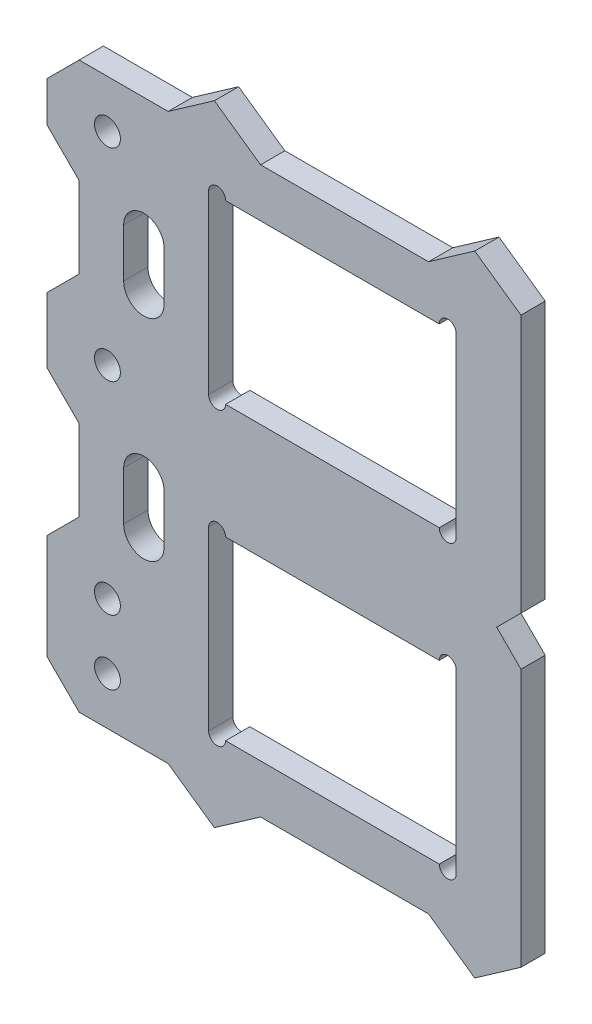
from build123d import *

# Parameters (mm, degrees)
SKETCH_1_R      = 1.6
EXTRUDE_1_DEPTH = 3
CHAMFER_1_SIZE  = 4


with BuildPart() as part:
    # 草图1 → 凸台-拉伸1 (new body)
    with BuildSketch(Plane.XY):
        Polygon((-20.3, 16.9), (-35.3, 16.9), (-35.3, 8), (-31.3, 4), (-31.3, -6), (-35.3, -10), (-35.3, -18), (-31.3, -22), (-31.3, -32), (-35.3, -36), (-35.3, -52.9), (-20.3, -52.9), (-14.587407973, -56.9), (-8.874815946, -52.9), (11.874815946, -52.9), (17.587407973, -56.9), (23.3, -52.9), (23.3, -21), (20.3, -18), (23.3, -15), (23.3, 16.9), (17.587407973, 20.9), (11.874815946, 16.9), (-8.874815946, 16.9), (-14.587407973, 20.9), align=None)
        with Locations((-27.8, -47)):
            Circle(SKETCH_1_R, mode=Mode.SUBTRACT)
        with Locations((-27.8, -39)):
            Circle(SKETCH_1_R, mode=Mode.SUBTRACT)
        with BuildLine():
            ThreePointArc((-20.8, -30), (-23.3, -32.5), (-25.8, -30))
            Line((-25.8, -30), (-25.8, -24))
            ThreePointArc((-25.8, -24), (-23.3, -21.5), (-20.8, -24))
            Line((-20.8, -24), (-20.8, -30))
        make_face(mode=Mode.SUBTRACT)
        with BuildLine():
            Line((13.2, -46.9), (-13.2, -46.9))
            ThreePointArc((-13.2, -46.9), (-14.25, -47.95), (-15.3, -46.9))
            Line((-15.3, -46.9), (-15.3, -25.1))
            ThreePointArc((-15.3, -25.1), (-14.25, -24.05), (-13.2, -25.1))
            Line((-13.2, -25.1), (13.2, -25.1))
            ThreePointArc((13.2, -25.1), (14.25, -24.05), (15.3, -25.1))
            Line((15.3, -25.1), (15.3, -46.9))
            ThreePointArc((15.3, -46.9), (14.25, -47.95), (13.2, -46.9))
        make_face(mode=Mode.SUBTRACT)
        with Locations((-27.8, -14)):
            Circle(SKETCH_1_R, mode=Mode.SUBTRACT)
        with BuildLine():
            Line((-25.8, -4), (-25.8, 2))
            ThreePointArc((-25.8, 2), (-23.3, 4.5), (-20.8, 2))
            Line((-20.8, 2), (-20.8, -4))
            ThreePointArc((-20.8, -4), (-23.3, -6.5), (-25.8, -4))
        make_face(mode=Mode.SUBTRACT)
        with Locations((-27.8, 11)):
            Circle(SKETCH_1_R, mode=Mode.SUBTRACT)
        with BuildLine():
            Line((13.2, -10.9), (-13.2, -10.9))
            ThreePointArc((-13.2, -10.9), (-14.25, -11.95), (-15.3, -10.9))
            Line((-15.3, -10.9), (-15.3, 10.9))
            ThreePointArc((-15.3, 10.9), (-14.25, 11.95), (-13.2, 10.9))
            Line((-13.2, 10.9), (13.2, 10.9))
            ThreePointArc((13.2, 10.9), (14.25, 11.95), (15.3, 10.9))
            Line((15.3, 10.9), (15.3, -10.9))
            ThreePointArc((15.3, -10.9), (14.25, -11.95), (13.2, -10.9))
        make_face(mode=Mode.SUBTRACT)
    extrude(amount=EXTRUDE_1_DEPTH)

    # 倒角1
    chamfer_1_edges = [part.edges().sort_by_distance(p)[0] for p in [
        (-35.3, 16.9, 1.5),
        (-35.3, -52.9, 1.5),
    ]]
    chamfer(chamfer_1_edges, length=CHAMFER_1_SIZE)


solid = part.part
